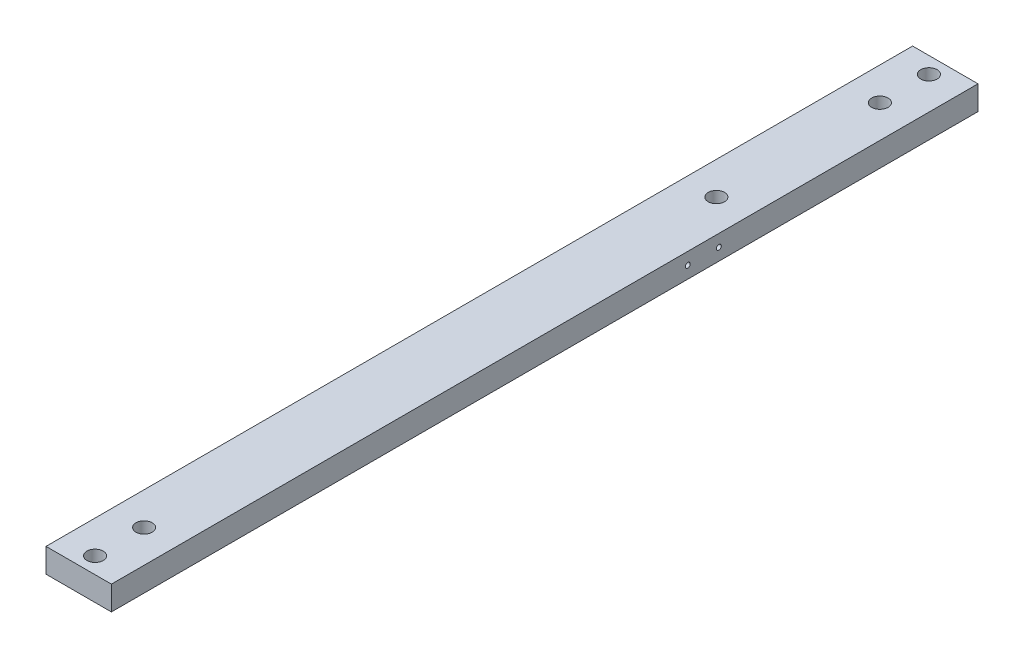
from build123d import *

# Parameters (mm, degrees)
SKETCH_1_W          = 8
SKETCH_1_H          = 106
EXTRUDE_1_DEPTH     = 2.95
SKETCH_2_R          = 0.7
CUT_EXTRUDE_1_DEPTH = 107.342383366
SKETCH_2_3_R        = 1
CUT_EXTRUDE_2_DEPTH = 1.5
SKETCH_3_R          = 0.3
CUT_EXTRUDE_3_DEPTH = 107.342383366


with BuildPart() as part:
    # 草图1 → 凸台-拉伸1 (new body)
    with BuildSketch(Plane(origin=(0, 0, 0), x_dir=(1, 0, 0), z_dir=(0, 1, 0))):
        with Locations((4, -53)):
            Rectangle(SKETCH_1_W, SKETCH_1_H)
    extrude(amount=EXTRUDE_1_DEPTH)

    # 草图2 → 切除-拉伸1 (cut, through all)
    with BuildSketch(Plane(origin=(0, 2.95, 0), x_dir=(1, 0, 0), z_dir=(0, 1, 0))):
        with Locations((4, -8)):
            Circle(SKETCH_2_R)
        with Locations((4, -2)):
            Circle(SKETCH_2_R)
        with Locations((4, -104)):
            Circle(SKETCH_2_R)
        with Locations((4, -98)):
            Circle(SKETCH_2_R)
        with Locations((4, -28)):
            Circle(SKETCH_2_R)
    extrude(amount=-CUT_EXTRUDE_1_DEPTH, mode=Mode.SUBTRACT)

    # 草图2<3> → 切除-拉伸2 (cut)
    with BuildSketch(Plane(origin=(0, 2.95, 0), x_dir=(1, 0, 0), z_dir=(0, 1, 0))):
        with Locations((4, -8)):
            Circle(SKETCH_2_3_R)
        with Locations((4, -2)):
            Circle(SKETCH_2_3_R)
        with Locations((4, -104)):
            Circle(SKETCH_2_3_R)
        with Locations((4, -98)):
            Circle(SKETCH_2_3_R)
        with Locations((4, -28)):
            Circle(SKETCH_2_3_R)
    extrude(amount=-CUT_EXTRUDE_2_DEPTH, mode=Mode.SUBTRACT)

    # 草图3 → 切除-拉伸3 (cut, through all)
    with BuildSketch(Plane(origin=(8, 0, 0), x_dir=(0, 0, -1), z_dir=(1, 0, 0))):
        with Locations((-31.7, 1.475)):
            Circle(SKETCH_3_R)
        with Locations((-35.5, 1.475)):
            Circle(SKETCH_3_R)
    extrude(amount=-CUT_EXTRUDE_3_DEPTH, mode=Mode.SUBTRACT)


solid = part.part
